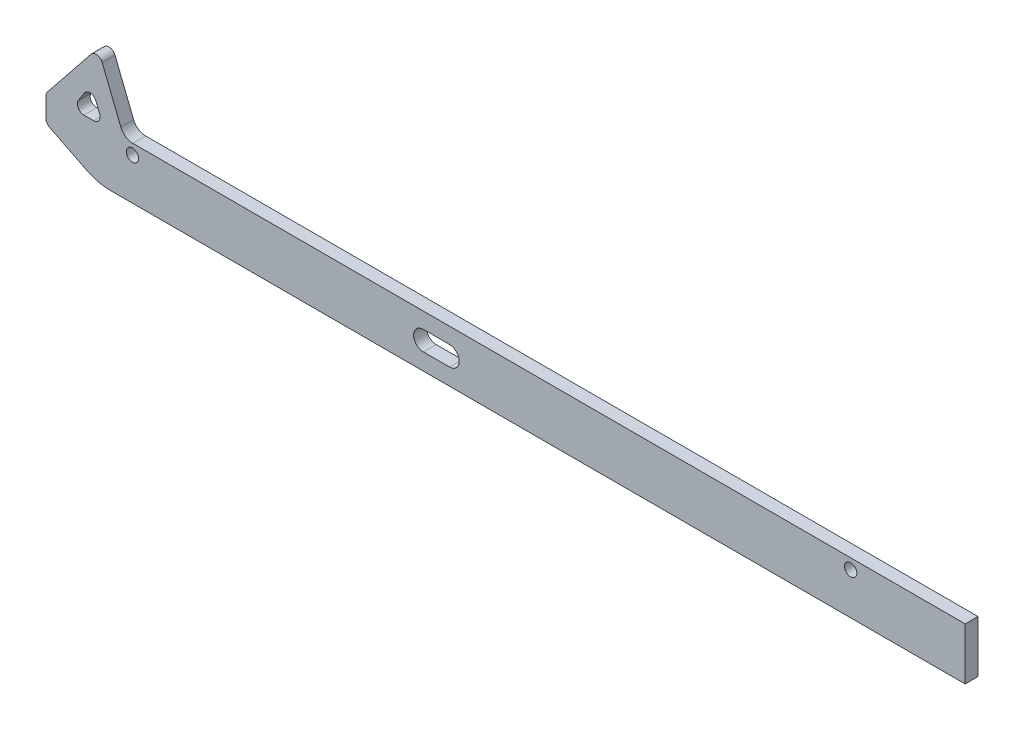
from build123d import *

# Parameters (mm, degrees)
BOSS_EXTRUDE1_DEPTH = 3.1242
FILLET4_R           = 12.7
FILLET8_R           = 1.5875
FILLET9_R           = 3.175
CUT_EXTRUDE1_DEPTH  = 116.691473387
SKETCH3_R           = 1.5
CUT_EXTRUDE2_DEPTH  = 116.691473387


with BuildPart() as part:
    # Sketch1 → Boss-Extrude1 (new body)
    with BuildSketch(Plane.XY):
        Polygon((113.799832915, -6.443650697), (-97.791946085, -6.443650697), (-110.491946085, -0.093650697), (-110.491946085, 6.256349303), (-97.791946085, 22.131349303), (-91.441946085, 6.256349303), (113.799832915, 6.256349303), align=None)
        Polygon((-104.141946085, 6.256349303), (-99.460780317, 13.603434884), (-96.521946085, 6.256349303), align=None, mode=Mode.SUBTRACT)
    extrude(amount=BOSS_EXTRUDE1_DEPTH)

    # Fillet4
    fillet4_edges = [part.edges().sort_by_distance(p)[0] for p in [
        (-97.791946085, -6.443650697, 1.5621),
    ]]
    fillet(fillet4_edges, radius=FILLET4_R)

    # Fillet8
    fillet8_edges = [part.edges().sort_by_distance(p)[0] for p in [
        (-110.491946085, 6.256349303, 1.5621),
        (-97.791946085, 22.131349303, 1.5621),
        (-110.491946085, -0.093650697, 1.5621),
        (-104.141946085, 6.256349303, 1.5621),
        (-96.521946085, 6.256349303, 1.5621),
        (-99.460780317, 13.603434884, 1.5621),
    ]]
    fillet(fillet8_edges, radius=FILLET8_R)

    # Fillet9
    fillet9_edges = [part.edges().sort_by_distance(p)[0] for p in [
        (-91.441946085, 6.256349303, 1.5621),
    ]]
    fillet(fillet9_edges, radius=FILLET9_R)

    # Sketch2 → Cut-Extrude1 (cut, through all)
    with BuildSketch(Plane.XY.offset(3.1242)):
        with BuildLine():
            Line((-18.407167085, 2.38125), (-12.057167085, 2.38125))
            ThreePointArc((-12.057167085, 2.38125), (-9.675917085, 0), (-12.057167085, -2.38125))
            Line((-12.057167085, -2.38125), (-18.407167085, -2.38125))
            ThreePointArc((-18.407167085, -2.38125), (-20.788417085, 0), (-18.407167085, 2.38125))
        make_face()
    extrude(amount=-CUT_EXTRUDE1_DEPTH, mode=Mode.SUBTRACT)

    # Sketch3 → Cut-Extrude2 (cut, through all)
    with BuildSketch(Plane.XY.offset(3.1242)):
        with Locations((85.859832915, 3.716349303)):
            Circle(SKETCH3_R)
        with Locations((-89.400167085, 3.716349303)):
            Circle(SKETCH3_R)
    extrude(amount=-CUT_EXTRUDE2_DEPTH, mode=Mode.SUBTRACT)


solid = part.part
